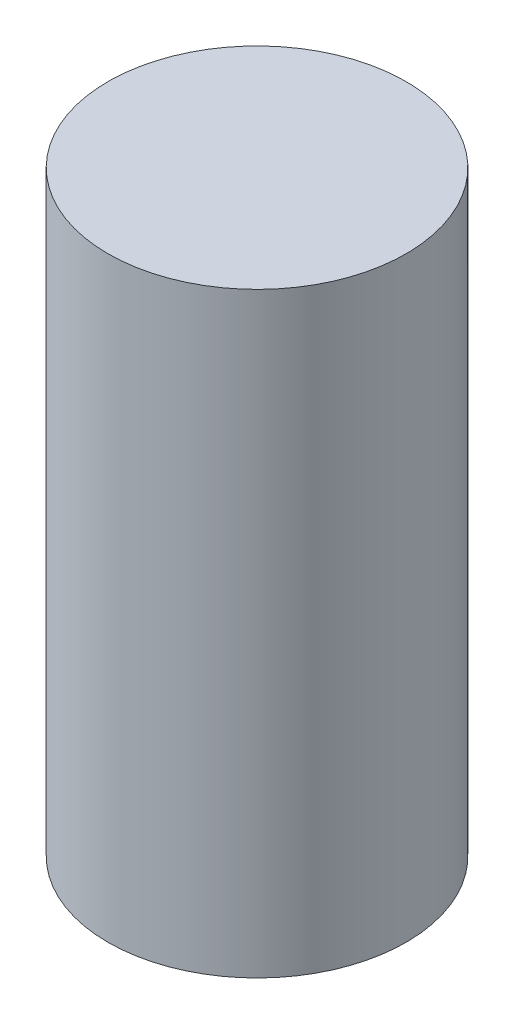
from build123d import *

# Parameters (mm, degrees)
SKETCH1_R           = 6.35
BOSS_EXTRUDE1_DEPTH = 12.7


with BuildPart() as part:
    # Sketch1 → Boss-Extrude1 (new, symmetric)
    with BuildSketch(Plane(origin=(0, 0, 0), x_dir=(1, 0, 0), z_dir=(0, 1, 0))):
        with Locations(Location((0, 0, 0), (0, 0, 270))):
            Circle(SKETCH1_R)
    extrude(amount=BOSS_EXTRUDE1_DEPTH, both=True)


solid = part.part
